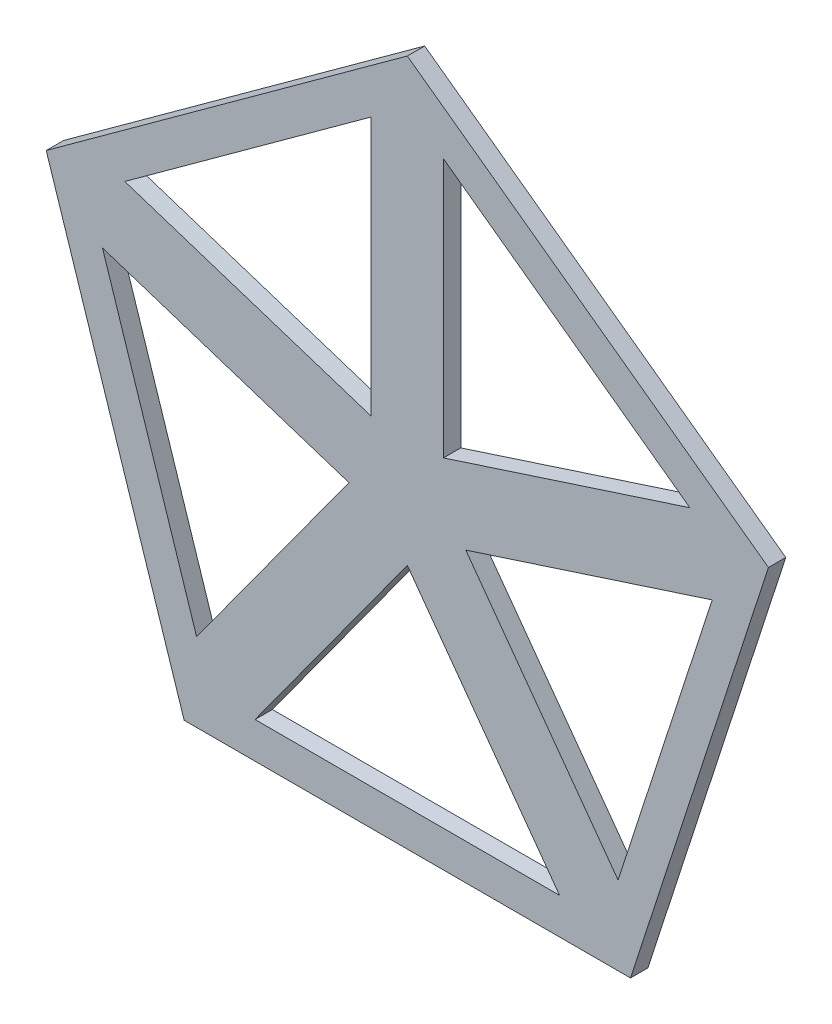
from build123d import *

# Parameters (mm, degrees)
BOSS_EXTRUDE1_DEPTH = 1.2


with BuildPart() as part:
    # Sketch1 → Boss-Extrude1 (new body)
    with BuildSketch(Plane.XY):
        Polygon((0, 26.286555606), (-25, 8.122992406), (-15.450849719, -21.266270209), (15.450849719, -21.266270209), (25, 8.122992406), align=None)
        Polygon((-21.10615871, 4.229151116), (-4.045084972, -1.31432778), (-14.589408427, -15.827343947), align=None, mode=Mode.SUBTRACT)
        Polygon((14.589408427, -15.827343947), (21.10615871, 4.229151116), (4.045084972, -1.31432778), align=None, mode=Mode.SUBTRACT)
        Polygon((-19.561073739, 8.984433698), (-2.5, 3.440954801), (-2.5, 21.380029342), align=None, mode=Mode.SUBTRACT)
        Polygon((2.5, 21.380029342), (2.5, 3.440954801), (19.561073739, 8.984433698), align=None, mode=Mode.SUBTRACT)
        Polygon((-10.544323455, -18.766270209), (0, -4.253254042), (10.544323455, -18.766270209), align=None, mode=Mode.SUBTRACT)
    extrude(amount=BOSS_EXTRUDE1_DEPTH)


solid = part.part
